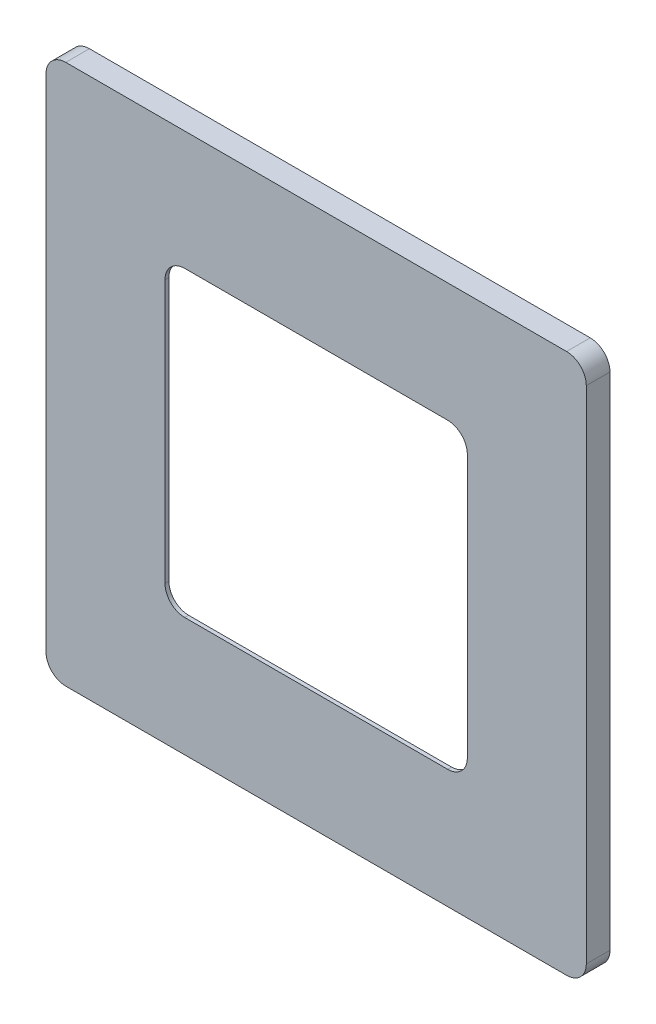
from build123d import *

# Parameters (mm, degrees)
SKETCH1_W           = 82.2
SKETCH1_H           = 3.6
BOSS_EXTRUDE1_DEPTH = 82.2
SKETCH2_W           = 76.4
SKETCH2_H           = 76.4
CUT_EXTRUDE1_DEPTH  = 1.31
SKETCH4_R           = 1
CUT_EXTRUDE3_DEPTH  = 1.31
SKETCH3_W           = 46
SKETCH3_H           = 46
CUT_EXTRUDE2_DEPTH  = 92.930920261
SKETCH6_W           = 50.3
SKETCH6_H           = 50.3
CUT_EXTRUDE4_DEPTH  = 1.7
FILLET1_R           = 3
FILLET2_R           = 2


with BuildPart() as part:
    # Sketch1 → Boss-Extrude1 (new body)
    with BuildSketch(Plane(origin=(0, 0, 0), x_dir=(1, 0, 0), z_dir=(0, 1, 0))):
        with Locations((0, 1.8)):
            Rectangle(SKETCH1_W, SKETCH1_H)
    extrude(amount=BOSS_EXTRUDE1_DEPTH)

    # Sketch2 → Cut-Extrude1 (cut)
    with BuildSketch(Plane(origin=(0, 0, -3.6), x_dir=(-1, 0, 0), z_dir=(0, 0, -1))):
        with Locations((0, 41.1)):
            Rectangle(SKETCH2_W, SKETCH2_H)
    extrude(amount=-CUT_EXTRUDE1_DEPTH, mode=Mode.SUBTRACT)

    # Sketch4 → Cut-Extrude3 (cut)
    with BuildSketch(Plane(origin=(0, 0, -3.6), x_dir=(-1, 0, 0), z_dir=(0, 0, -1))):
        with Locations((38.2, 2.9)):
            Circle(SKETCH4_R)
        with Locations((38.2, 79.3)):
            Circle(SKETCH4_R)
        with Locations((-38.2, 2.9)):
            Circle(SKETCH4_R)
        with Locations((-38.2, 79.3)):
            Circle(SKETCH4_R)
    extrude(amount=-CUT_EXTRUDE3_DEPTH, mode=Mode.SUBTRACT)

    # Sketch3 → Cut-Extrude2 (cut, through all)
    with BuildSketch(Plane(origin=(0, 0, -2.29), x_dir=(-1, 0, 0), z_dir=(0, 0, -1))):
        with Locations((0, 41.1)):
            Rectangle(SKETCH3_W, SKETCH3_H)
    extrude(amount=-CUT_EXTRUDE2_DEPTH, mode=Mode.SUBTRACT)

    # Sketch6 → Cut-Extrude4 (cut)
    with BuildSketch(Plane.XY.offset(-2.29)):
        with Locations((0, 41.1)):
            Rectangle(SKETCH6_W, SKETCH6_H)
    extrude(amount=CUT_EXTRUDE4_DEPTH, mode=Mode.SUBTRACT)

    # Fillet1
    fillet1_edges = [part.edges().sort_by_distance(p)[0] for p in [
        (-41.1, 82.2, -1.8),
        (41.1, 82.2, -1.8),
        (-41.1, 0, -1.8),
        (41.1, 0, -1.8),
        (23, 18.1, -0.295),
        (23, 64.1, -0.295),
        (-23, 64.1, -0.295),
        (-23, 18.1, -0.295),
    ]]
    fillet(fillet1_edges, radius=FILLET1_R)

    # Fillet2
    fillet2_edges = [part.edges().sort_by_distance(p)[0] for p in [
        (-37.2, 79.3, -2.945),
        (-38.2, 78.3, -2.945),
        (38.2, 3.9, -2.945),
        (37.2, 2.9, -2.945),
        (38.2, 78.3, -2.945),
        (37.2, 79.3, -2.945),
        (-38.2, 3.9, -2.945),
        (-37.2, 2.9, -2.945),
    ]]
    fillet(fillet2_edges, radius=FILLET2_R)


solid = part.part
